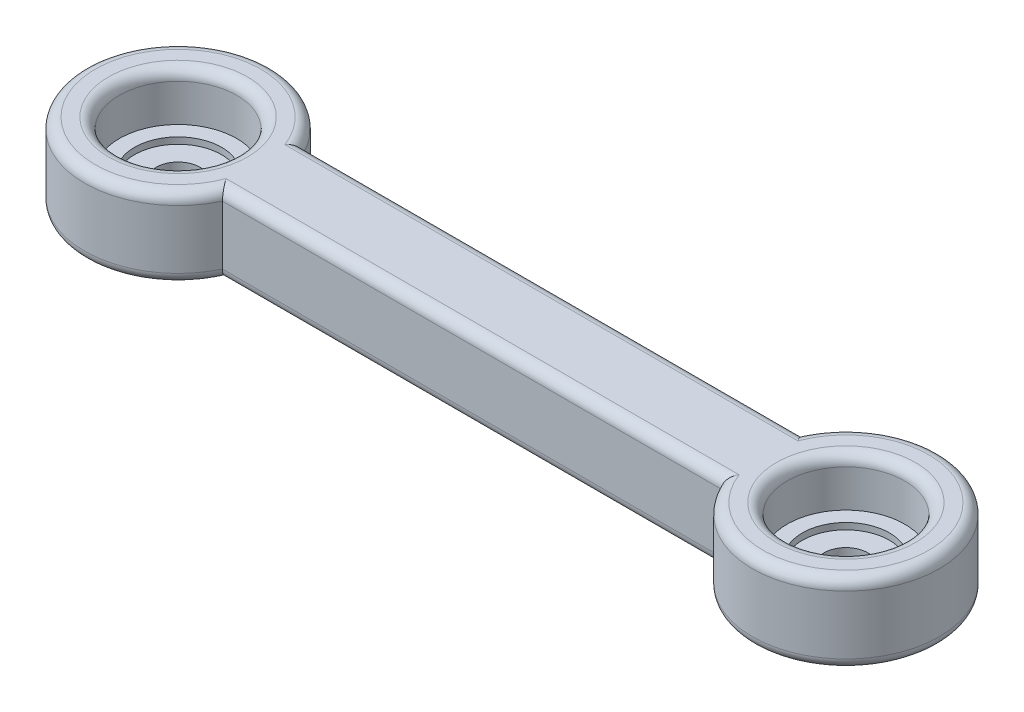
from build123d import *

# Parameters (mm, degrees)
SKETCH1_R           = 11
BOSS_EXTRUDE1_DEPTH = 15
SKETCH2_R           = 11
BOSS_EXTRUDE2_DEPTH = 6
SKETCH3_R           = 8.16
CUT_EXTRUDE1_DEPTH  = 1.2
FILLET2_R           = 2
SKETCH9_R           = 4.1
CUT_EXTRUDE4_DEPTH  = 4.8


with BuildPart() as part:
    # Sketch1 → Boss-Extrude1 (new body)
    with BuildSketch(Plane(origin=(0, 0, 0), x_dir=(1, 0, 0), z_dir=(0, 1, 0))):
        with BuildLine():
            Line((-46.688611699, 7.5), (46.688611699, 7.5))
            ThreePointArc((46.688611699, 7.5), (80, 0), (46.688611699, -7.5))
            Line((46.688611699, -7.5), (-46.688611699, -7.5))
            ThreePointArc((-46.688611699, -7.5), (-80, 0), (-46.688611699, 7.5))
        make_face()
        with Locations(Location((-62.5, 0, 0), (0, 0, 270))):
            Circle(SKETCH1_R, mode=Mode.SUBTRACT)
        with Locations(Location((62.5, 0, 0), (0, 0, 270))):
            Circle(SKETCH1_R, mode=Mode.SUBTRACT)
    extrude(amount=BOSS_EXTRUDE1_DEPTH)

    # Sketch2 → Boss-Extrude2 (add)
    with BuildSketch(Plane(origin=(0, 0, 0), x_dir=(1, 0, 0), z_dir=(0, 1, 0))):
        with Locations(Location((62.5, 0, 0), (0, 0, 270))):
            Circle(SKETCH2_R)
        with Locations(Location((-62.5, 0, 0), (0, 0, 270))):
            Circle(SKETCH2_R)
    extrude(amount=BOSS_EXTRUDE2_DEPTH)

    # Sketch3 → Cut-Extrude1 (cut)
    with BuildSketch(Plane(origin=(0, 6, 0), x_dir=(1, 0, 0), z_dir=(0, 1, 0))):
        with Locations(Location((-62.5, 0, 0), (0, 0, 270))):
            Circle(SKETCH3_R)
        with Locations(Location((62.5, 0, 0), (0, 0, 270))):
            Circle(SKETCH3_R)
    extrude(amount=-CUT_EXTRUDE1_DEPTH, mode=Mode.SUBTRACT)

    # Fillet2
    fillet2_edges = [part.edges().sort_by_distance(p)[0] for p in [
        (-80, 15, 0),
        (-62.5, 15, -11),
        (0, 15, 7.5),
        (62.5, 15, -11),
        (80, 15, 0),
        (0, 0, 7.5),
        (-80, 0, 0),
        (0, 0, -7.5),
        (80, 0, 0),
        (0, 15, -7.5),
    ]]
    fillet(fillet2_edges, radius=FILLET2_R)

    # Sketch9 → Cut-Extrude4 (cut)
    with BuildSketch(Plane(origin=(0, 4.8, 0), x_dir=(1, 0, 0), z_dir=(0, 1, 0))):
        with Locations(Location((-62.5, 0, 0), (0, 0, 270))):
            Circle(SKETCH9_R)
        with Locations(Location((62.5, 0, 0), (0, 0, 270))):
            Circle(SKETCH9_R)
    extrude(amount=-CUT_EXTRUDE4_DEPTH, mode=Mode.SUBTRACT)


solid = part.part
